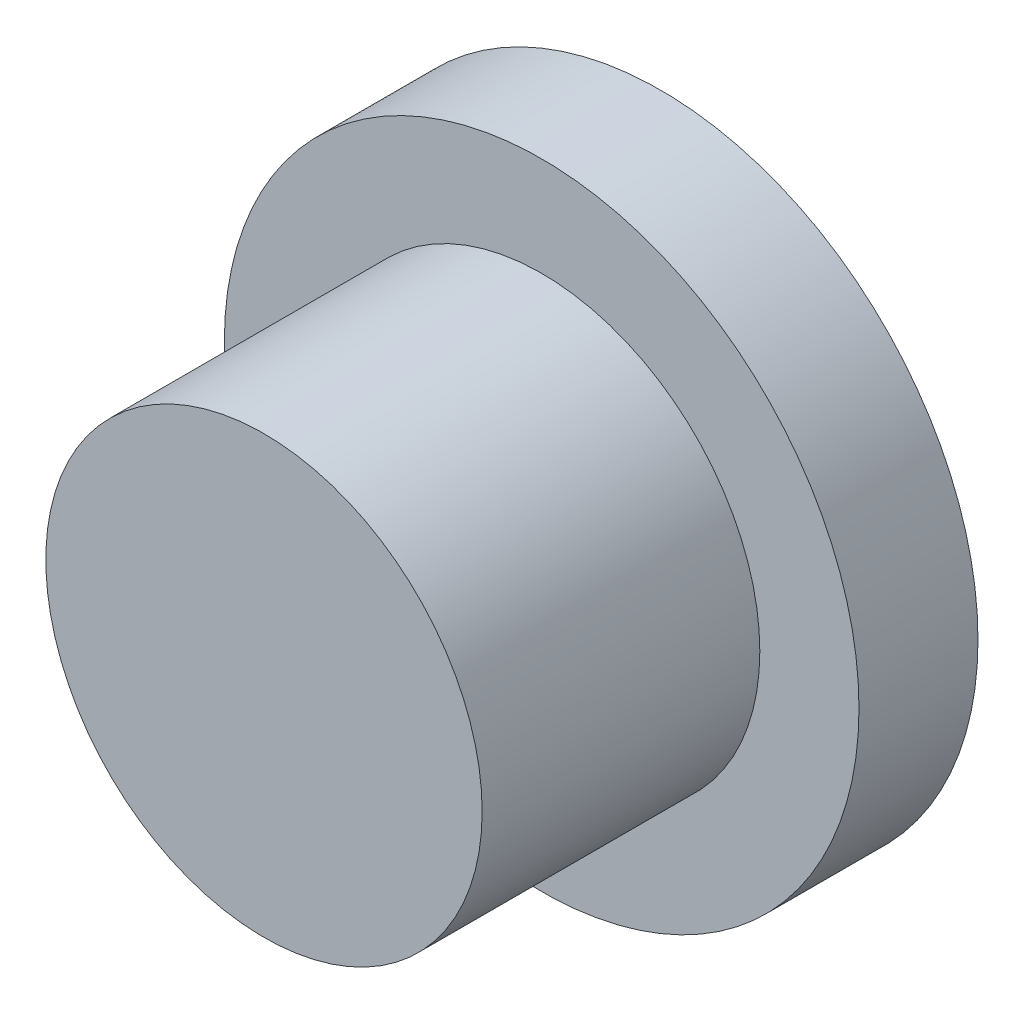
from build123d import *

# Parameters (mm, degrees)
PLUG_SHAFT_SKETCH_R = 11
PLUG_SHAFT_DEPTH    = 20
PLUG_HEAD_SKETCH_R  = 16
PLUG_HEAD_DEPTH     = 6


with BuildPart() as part:
    # Plug Shaft Sketch → Plug Shaft (new body)
    with BuildSketch(Plane.XY):
        Circle(PLUG_SHAFT_SKETCH_R)
    extrude(amount=PLUG_SHAFT_DEPTH)

    # Plug Head Sketch → Plug Head (add)
    with BuildSketch(Plane.XY):
        Circle(PLUG_HEAD_SKETCH_R)
    extrude(amount=PLUG_HEAD_DEPTH)


solid = part.part
